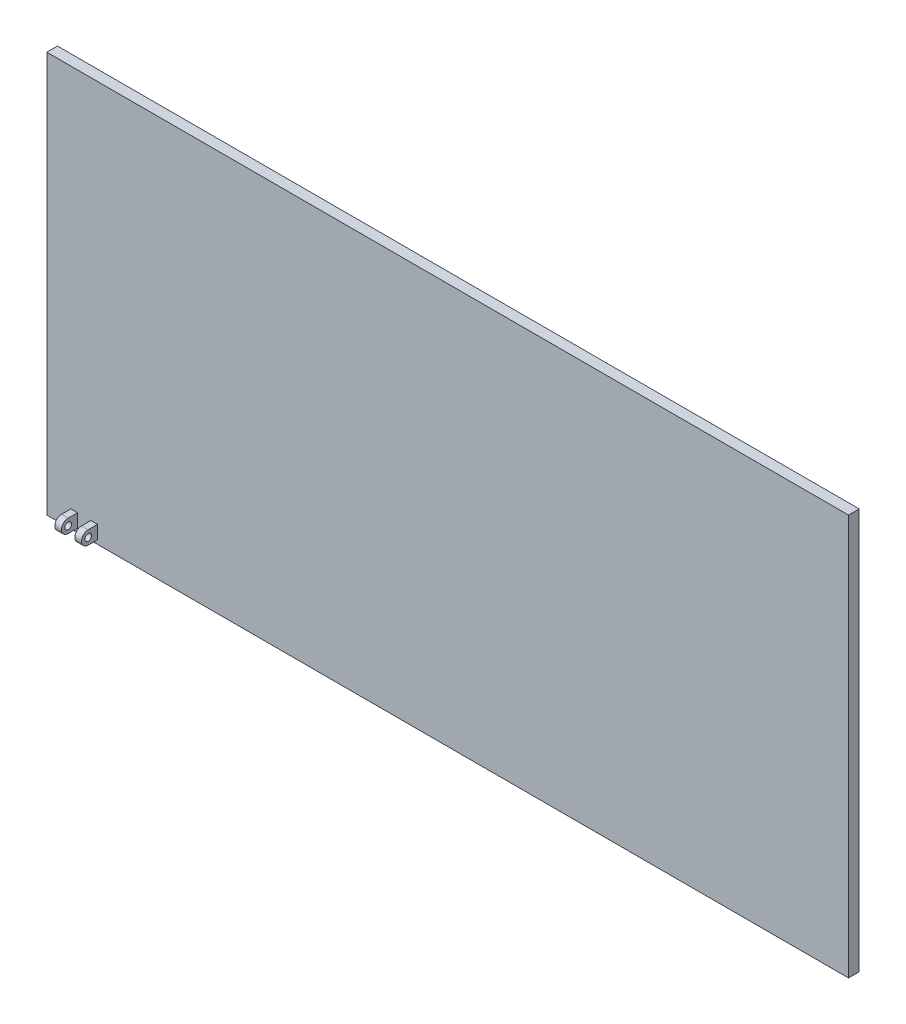
from build123d import *

# Parameters (mm, degrees)
ESQUISSE1_W             = 3000
ESQUISSE1_H             = 1500
BOSS_EXTRU_1_DEPTH      = 20
BOSS_EXTRU_2_DEPTH      = 280
ESQUISSE4_R             = 13.37
ENL_V_MAT_EXTRU_1_DEPTH = 3473.751070837
ESQUISSE5_R             = 12.5
BOSS_EXTRU_3_DEPTH      = 50
ESQUISSE6_W             = 73.651656562
ESQUISSE6_H             = 85.918496535
ENL_V_MAT_EXTRU_2_DEPTH = 25


with BuildPart() as part:
    # Esquisse1 → Boss.-Extru.1 (new, symmetric)
    with BuildSketch(Plane.XY):
        with Locations((1500, 750)):
            Rectangle(ESQUISSE1_W, ESQUISSE1_H)
    extrude(amount=BOSS_EXTRU_1_DEPTH, both=True)

    # Esquisse3 → Boss.-Extru.2 (add)
    with BuildSketch(Plane(origin=(0, 0, 0), x_dir=(0, 0, -1), z_dir=(1, 0, 0))):
        Polygon((880, -519.615242271), (830, -490.747728811), (830, -761.880215352), (880, -761.880215352), align=None)
        Polygon((880, -519.615242271), (880, -461.880215352), (830, -461.880215352), (830, -490.747728811), align=None)
        Polygon((880, -461.880215352), (-20, 57.735026919), (-20, 0), (830, -490.747728811), (830, -461.880215352), align=None)
    extrude(amount=BOSS_EXTRU_2_DEPTH)

    # Esquisse4 → Enlèv. mat.-Extru.1 (cut, through all)
    with BuildSketch(Plane(origin=(0, 0, -880), x_dir=(-1, 0, 0), z_dir=(0, 0, -1))):
        with Locations((-140, -563.577557423)):
            Circle(ESQUISSE4_R)
        with Locations((-68.168671163, -687.993068543)):
            Circle(ESQUISSE4_R)
        with Locations((-211.831328836, -687.993068543)):
            Circle(ESQUISSE4_R)
    extrude(amount=-ENL_V_MAT_EXTRU_1_DEPTH, mode=Mode.SUBTRACT)

    # Esquisse5 → Boss.-Extru.3 (add, symmetric)
    with BuildSketch(Plane.ZY.offset(-140)):
        with BuildLine():
            Line((55, 15), (20, 15))
            Line((20, 15), (20, 65))
            Line((20, 65), (55, 65))
            ThreePointArc((55, 65), (80, 40), (55, 15))
        make_face()
        with Locations(Location((55, 40, 0), (0, 0, 180))):
            Circle(ESQUISSE5_R, mode=Mode.SUBTRACT)
    extrude(amount=BOSS_EXTRU_3_DEPTH, both=True)

    # Esquisse6 → Enlèv. mat.-Extru.2 (cut, symmetric)
    with BuildSketch(Plane.ZY.offset(-140)):
        with Locations((56.825828281, 42.959248268)):
            Rectangle(ESQUISSE6_W, ESQUISSE6_H)
    extrude(amount=ENL_V_MAT_EXTRU_2_DEPTH, both=True, mode=Mode.SUBTRACT)


solid = part.part
